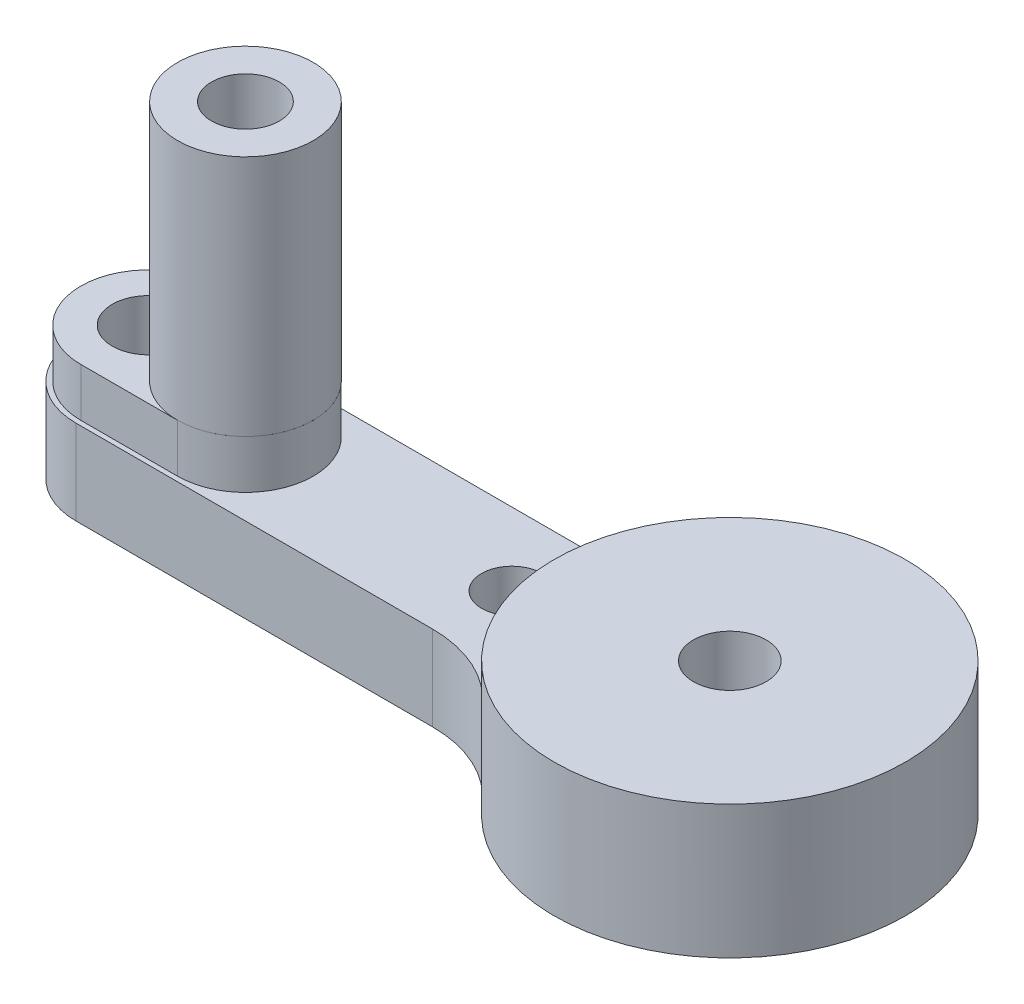
from build123d import *

# Parameters (mm, degrees)
SKETCH_1_R      = 1.5
SKETCH_1_R_2    = 1.25
EXTRUDE_1_DEPTH = 3.5
SKETCH_2_R      = 7.25
SKETCH_2_R_2    = 1.5
EXTRUDE_2_DEPTH = 2
SKETCH_5_R      = 2.8
SKETCH_5_R_2    = 1.4
EXTRUDE_5_DEPTH = 10


with BuildPart() as part:
    # 草图1 → 凸台-拉伸1 (new body)
    with BuildSketch(Plane(origin=(0, 0, 0), x_dir=(1, 0, 0), z_dir=(0, 1, 0))):
        with BuildLine():
            Line((-24, -3), (-9.276987658, -3))
            ThreePointArc((-9.276987658, -3), (-7.194504838, -3.45431355), (-5.490462083, -4.734693878))
            ThreePointArc((-5.490462083, -4.734693878), (7.25, 0), (-5.490462083, 4.734693878))
            ThreePointArc((-5.490462083, 4.734693878), (-7.194504838, 3.45431355), (-9.276987658, 3))
            Line((-9.276987658, 3), (-24, 3))
            ThreePointArc((-24, 3), (-27, 0), (-24, -3))
        make_face()
        with Locations(Location((0, 0, 0), (0, 0, 270))):
            Circle(SKETCH_1_R, mode=Mode.SUBTRACT)
        with Locations(Location((-24, 0, 0), (0, 0, 270))):
            Circle(SKETCH_1_R, mode=Mode.SUBTRACT)
        with Locations(Location((-20, 0, 0), (0, 0, 270))):
            Circle(SKETCH_1_R, mode=Mode.SUBTRACT)
        with Locations(Location((-9, 0, 0), (0, 0, 270))):
            Circle(SKETCH_1_R_2, mode=Mode.SUBTRACT)
    extrude(amount=EXTRUDE_1_DEPTH)

    # 草图2 → 凸台-拉伸2 (add)
    # profile 1 of 2: a face of its own
    with BuildSketch(Plane(origin=(0, 3.5, 0), x_dir=(1, 0, 0), z_dir=(0, 1, 0))):
        with Locations(Location((0, 0, 0), (0, 0, 139.227195306))):
            Circle(SKETCH_2_R)
        with Locations(Location((0, 0, 0), (0, 0, 270))):
            Circle(SKETCH_2_R_2, mode=Mode.SUBTRACT)
    # profile 2 of 2: a face of its own
    with BuildSketch(Plane(origin=(0, 3.5, 0), x_dir=(1, 0, 0), z_dir=(0, 1, 0))):
        with BuildLine():
            Line((-24, 2.8), (-20, 2.8))
            ThreePointArc((-20, 2.8), (-17.2, 0), (-20, -2.8))
            Line((-20, -2.8), (-24, -2.8))
            ThreePointArc((-24, -2.8), (-26.8, 0), (-24, 2.8))
        make_face()
        with Locations(Location((-20, 0, 0), (0, 0, 270))):
            Circle(SKETCH_2_R_2, mode=Mode.SUBTRACT)
        with Locations(Location((-24, 0, 0), (0, 0, 270))):
            Circle(SKETCH_2_R_2, mode=Mode.SUBTRACT)
    extrude(amount=EXTRUDE_2_DEPTH)


with BuildPart() as body_2:
    # 草图5 → 凸台-拉伸5 (new body)
    with BuildSketch(Plane(origin=(0, 5.5, 0), x_dir=(1, 0, 0), z_dir=(0, 1, 0))):
        with Locations(Location((-20, 0, 0), (0, 0, 270))):
            Circle(SKETCH_5_R)
        with Locations(Location((-20, 0, 0), (0, 0, 270))):
            Circle(SKETCH_5_R_2, mode=Mode.SUBTRACT)
    extrude(amount=EXTRUDE_5_DEPTH)


solid = Compound([part.part, body_2.part])
